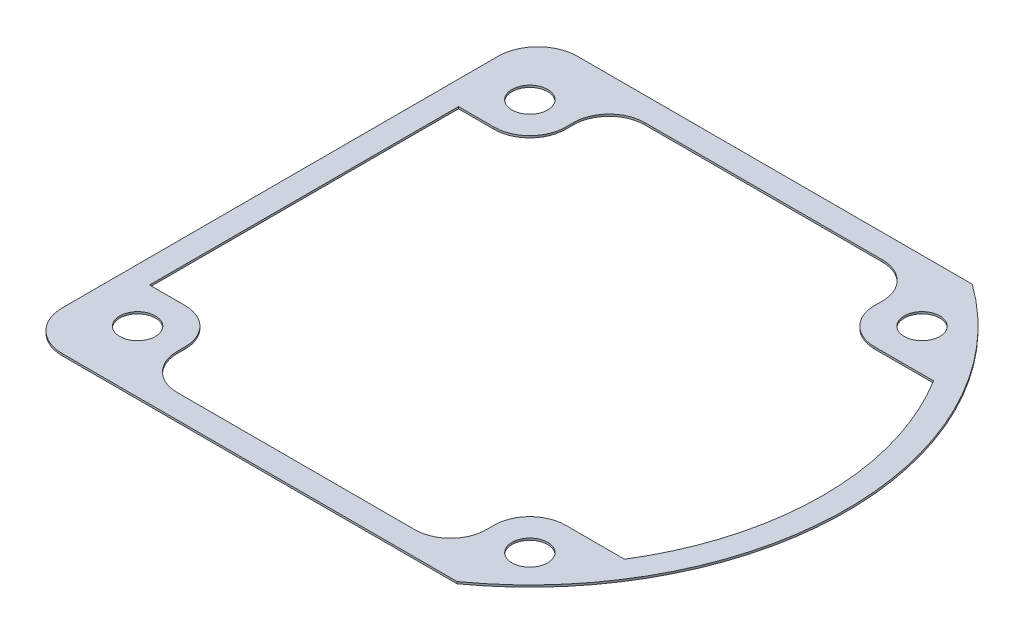
from build123d import *

# Parameters (mm, degrees)
BOSS_EXTRUDE1_DEPTH = 0.5
FILLET1_R           = 10
SKETCH27_R          = 4.5
CUT_EXTRUDE9_DEPTH  = 104.078853311
CUT_EXTRUDE17_DEPTH = 104.078853311


with BuildPart() as part:
    # Sketch1 → Boss-Extrude1 (new body)
    with BuildSketch(Plane(origin=(0, 0, 0), x_dir=(1, 0, 0), z_dir=(0, 1, 0))):
        with BuildLine():
            Line((-63, 65), (46.636895265, 65))
            ThreePointArc((46.636895265, 65), (80, 0), (46.636895265, -65))
            Line((46.636895265, -65), (-63, -65))
            Line((-63, -65), (-63, 65))
        make_face()
    extrude(amount=BOSS_EXTRUDE1_DEPTH)

    # Fillet1
    fillet1_edges = [part.edges().sort_by_distance(p)[0] for p in [
        (-63, 0.25, -65),
        (-63, 0.25, 65),
    ]]
    fillet(fillet1_edges, radius=FILLET1_R)

    # Sketch27 → Cut-Extrude9 (cut, through all)
    with BuildSketch(Plane(origin=(0, 0.5, 0), x_dir=(1, 0, 0), z_dir=(0, 1, 0))):
        with Locations(Location((-49.497474683, -49.497474683, 0), (0, 0, 270))):
            Circle(SKETCH27_R)
        with Locations(Location((49.497474683, -49.497474683, 0), (0, 0, 270))):
            Circle(SKETCH27_R)
        with Locations(Location((49.497474683, 49.497474683, 0), (0, 0, 270))):
            Circle(SKETCH27_R)
        with Locations(Location((-49.497474683, 49.497474683, 0), (0, 0, 270))):
            Circle(SKETCH27_R)
    extrude(amount=-CUT_EXTRUDE9_DEPTH, mode=Mode.SUBTRACT)

    # Sketch44 → Cut-Extrude17 (cut, through all)
    with BuildSketch(Plane(origin=(0, 0.5, 0), x_dir=(1, 0, 0), z_dir=(0, 1, 0))):
        with BuildLine():
            Line((47.997474683, 38.997474683), (62.89035672, 38.997474683))
            ThreePointArc((62.89035672, 38.997474683), (74, 0), (62.89035672, -38.997474683))
            Line((62.89035672, -38.997474683), (47.997474683, -38.997474683))
            ThreePointArc((47.997474683, -38.997474683), (41.633513652, -41.633513652), (38.997474683, -47.997474683))
            Line((38.997474683, -47.997474683), (38.997474683, -50))
            ThreePointArc((38.997474683, -50), (36.361435714, -56.363961031), (29.997474683, -59))
            Line((29.997474683, -59), (-29.997474683, -59))
            ThreePointArc((-29.997474683, -59), (-36.361435714, -56.363961031), (-38.997474683, -50))
            Line((-38.997474683, -50), (-38.997474683, -47.997474683))
            ThreePointArc((-38.997474683, -47.997474683), (-41.633513652, -41.633513652), (-47.997474683, -38.997474683))
            Line((-47.997474683, -38.997474683), (-57, -38.997474683))
            Line((-57, -38.997474683), (-57, 38.997474683))
            Line((-57, 38.997474683), (-47.997474683, 38.997474683))
            ThreePointArc((-47.997474683, 38.997474683), (-41.633513652, 41.633513652), (-38.997474683, 47.997474683))
            Line((-38.997474683, 47.997474683), (-38.997474683, 50))
            ThreePointArc((-38.997474683, 50), (-36.361435714, 56.363961031), (-29.997474683, 59))
            Line((-29.997474683, 59), (29.997474683, 59))
            ThreePointArc((29.997474683, 59), (36.361435714, 56.363961031), (38.997474683, 50))
            Line((38.997474683, 50), (38.997474683, 47.997474683))
            ThreePointArc((38.997474683, 47.997474683), (41.633513652, 41.633513652), (47.997474683, 38.997474683))
        make_face()
    extrude(amount=-CUT_EXTRUDE17_DEPTH, mode=Mode.SUBTRACT)


solid = part.part
